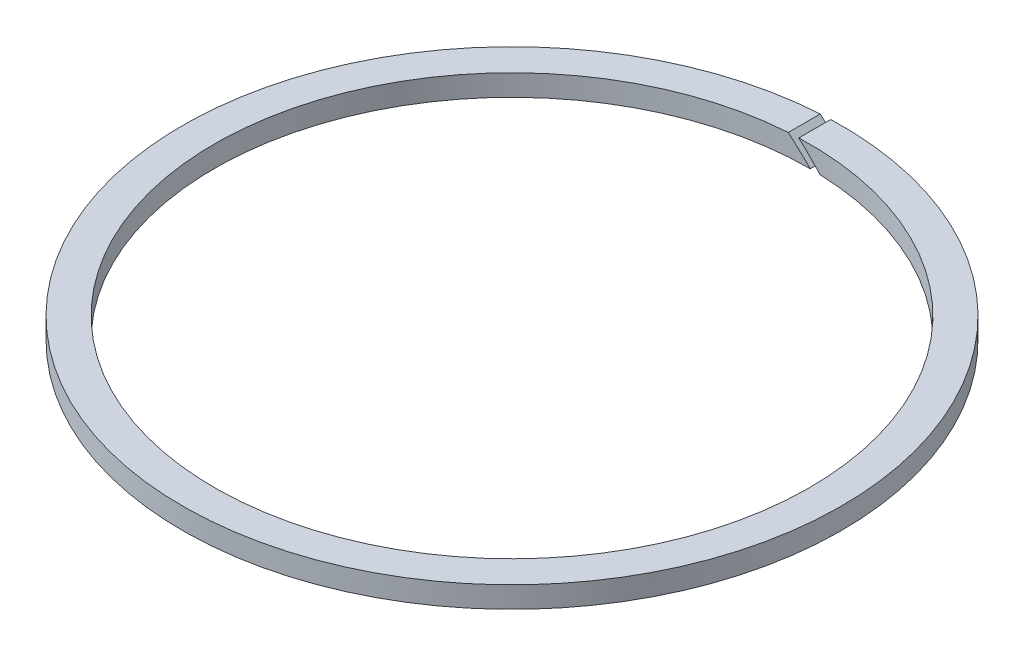
from build123d import *

# Parameters (mm, degrees)
SKETCH1_R           = 46.5
SKETCH1_R_2         = 42
BOSS_EXTRUDE1_DEPTH = 1.5
CUT_EXTRUDE1_DEPTH  = 66.778035848


with BuildPart() as part:
    # Sketch1 → Boss-Extrude1 (new, symmetric)
    with BuildSketch(Plane(origin=(0, 0, 0), x_dir=(1, 0, 0), z_dir=(0, 1, 0))):
        with Locations(Location((0, 0, 0), (0, 0, 270))):
            Circle(SKETCH1_R)
        with Locations(Location((0, 0, 0), (0, 0, 270))):
            Circle(SKETCH1_R_2, mode=Mode.SUBTRACT)
    extrude(amount=BOSS_EXTRUDE1_DEPTH, both=True)

    # Sketch2 → Cut-Extrude1 (cut, through all)
    with BuildSketch(Plane.XY):
        Polygon((0.085786438, -1.5), (1.5, -1.5), (-1.5, 1.5), (-2.914213562, 1.5), align=None)
    extrude(amount=-CUT_EXTRUDE1_DEPTH, mode=Mode.SUBTRACT)


solid = part.part
